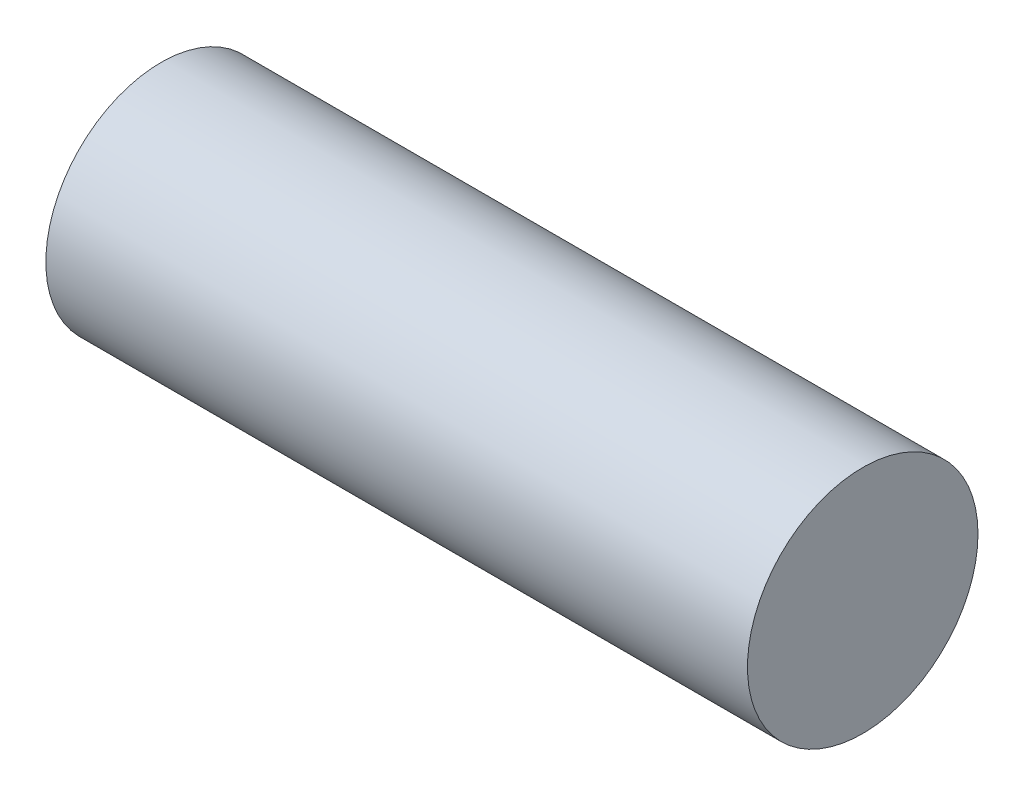
from build123d import *

# Parameters (mm, degrees)
SKETCH1_R = 2.3
PEG_DEPTH = 7


with BuildPart() as part:
    # Sketch1 → peg (new, symmetric)
    with BuildSketch(Plane(origin=(0, 0, 0), x_dir=(0, 0, -1), z_dir=(1, 0, 0))):
        Circle(SKETCH1_R)
    extrude(amount=PEG_DEPTH, both=True)


solid = part.part
